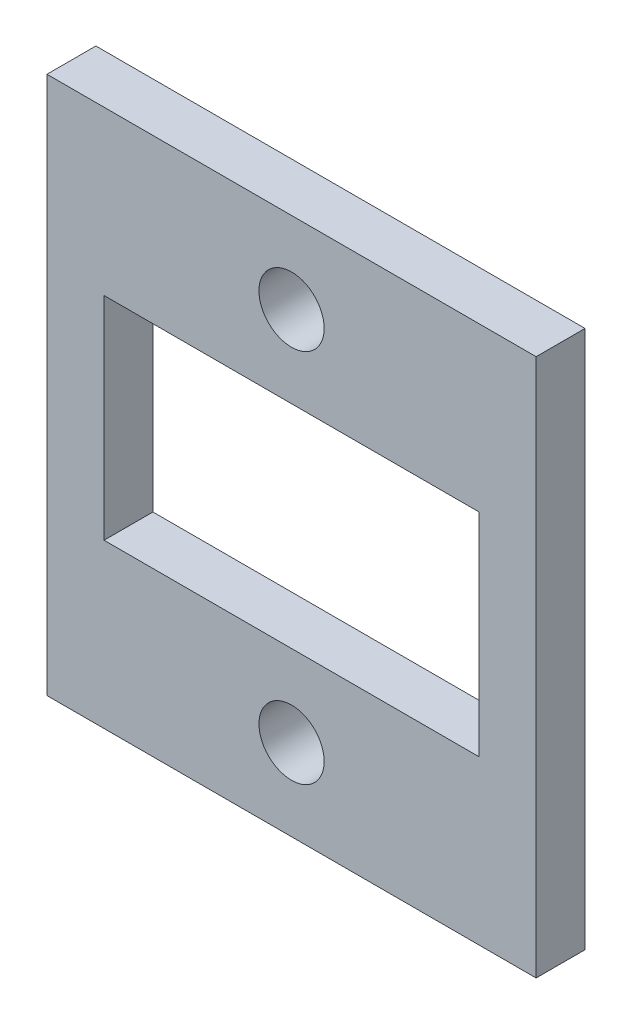
from build123d import *

# Parameters (mm, degrees)
SKETCH1_W           = 30
SKETCH1_H           = 33
BOSS_EXTRUDE1_DEPTH = 3
SKETCH2_W           = 23
SKETCH2_H           = 13
CUT_EXTRUDE1_DEPTH  = 23.5
SKETCH3_R           = 2
CUT_EXTRUDE2_DEPTH  = 3


with BuildPart() as part:
    # Sketch1 → Boss-Extrude1 (new body)
    with BuildSketch(Plane.XY):
        Rectangle(SKETCH1_W, SKETCH1_H)
    extrude(amount=BOSS_EXTRUDE1_DEPTH)

    # Sketch2 → Cut-Extrude1 (cut, through all)
    with BuildSketch(Plane.XY.offset(3)):
        Rectangle(SKETCH2_W, SKETCH2_H)
    extrude(amount=-CUT_EXTRUDE1_DEPTH, mode=Mode.SUBTRACT)

    # Sketch3 → Cut-Extrude2 (cut)
    with BuildSketch(Plane.XY.offset(3)):
        with Locations((0, 11.5)):
            Circle(SKETCH3_R)
        with Locations((0, -11.5)):
            Circle(SKETCH3_R)
    extrude(amount=-CUT_EXTRUDE2_DEPTH, mode=Mode.SUBTRACT)


solid = part.part
